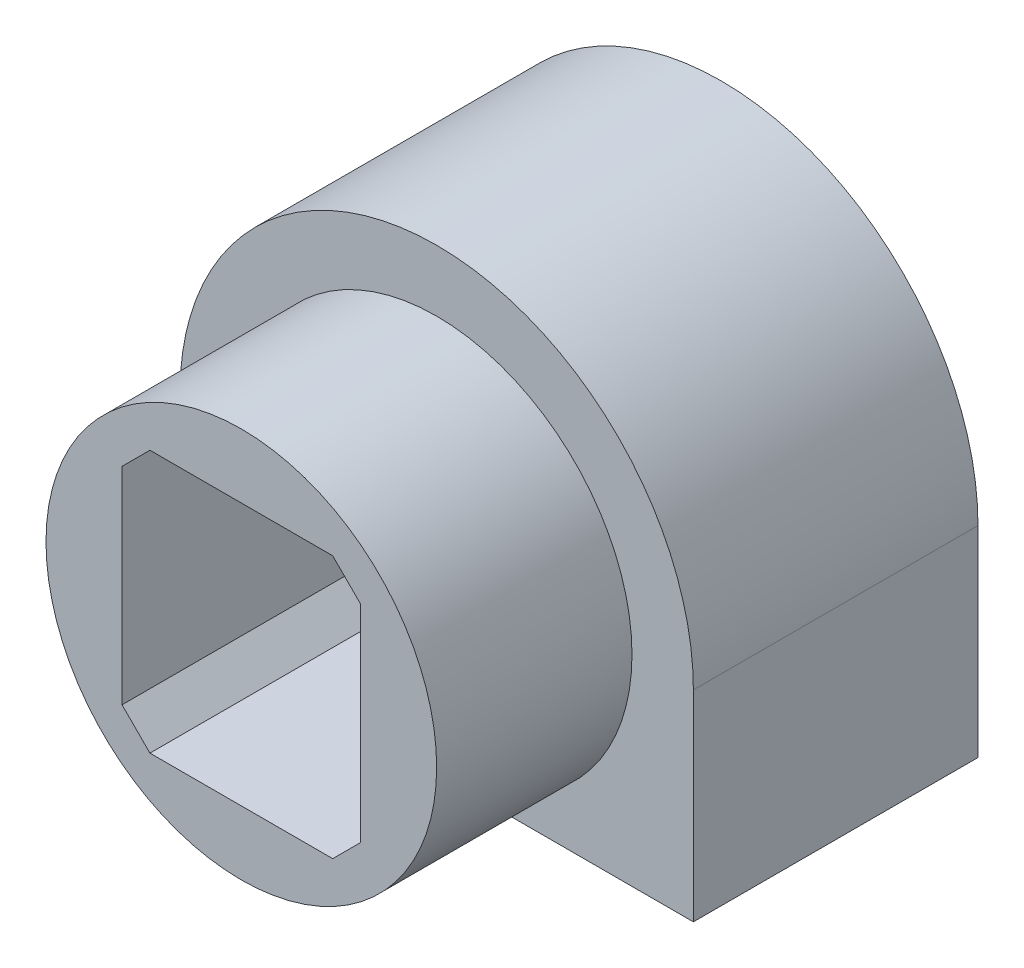
from build123d import *

# Parameters (mm, degrees)
SALIENTE_EXTRUIR1_DEPTH = 51
CROQUIS2_R              = 35
SALIENTE_EXTRUIR3_DEPTH = 35
CORTAR_EXTRUIR1_DEPTH   = 53
CORTAR_EXTRUIR2_DEPTH   = 30
CROQUIS6_R              = 1.5
CORTAR_EXTRUIR3_DEPTH   = 27
CORTAR_EXTRUIR4_DEPTH   = 29
CROQUIS8_R              = 1.5
CORTAR_EXTRUIR5_DEPTH   = 136.782914978
CORTAR_EXTRUIR6_DEPTH   = 4
CROQUIS10_R             = 1.5
CORTAR_EXTRUIR7_DEPTH   = 12.5
CROQUIS11_W             = 24
CROQUIS11_H             = 8
CORTAR_EXTRUIR8_DEPTH   = 18
CROQUIS12_R             = 3.5
CORTAR_EXTRUIR9_DEPTH   = 5
CROQUIS13_R             = 16.5
CORTAR_EXTRUIR10_DEPTH  = 3


with BuildPart() as part:
    # Croquis1 → Saliente-Extruir1 (new body)
    with BuildSketch(Plane.XY):
        with BuildLine():
            Line((0, 0), (92, 0))
            Line((92, 0), (92, 36))
            ThreePointArc((92, 36), (46, 82), (0, 36))
            Line((0, 36), (0, 0))
        make_face()
    extrude(amount=-SALIENTE_EXTRUIR1_DEPTH)

    # Croquis2 → Saliente-Extruir3 (add)
    with BuildSketch(Plane.XY):
        with Locations((46, 36)):
            Circle(CROQUIS2_R)
    extrude(amount=SALIENTE_EXTRUIR3_DEPTH)

    # Croquis4 → Cortar-Extruir1 (cut)
    with BuildSketch(Plane.XY.offset(35)):
        Polygon((24.625, 54.5), (29.625, 59.5), (62.375, 59.5), (67.375, 54.5), (67.375, 17.5), (62.375, 12.5), (29.625, 12.5), (24.625, 17.5), align=None)
    extrude(amount=-CORTAR_EXTRUIR1_DEPTH, mode=Mode.SUBTRACT)

    # Croquis5 → Cortar-Extruir2 (cut)
    with BuildSketch(Plane.XY.offset(-18)):
        with BuildLine():
            ThreePointArc((64.5, 36), (38.24596879, 52.796577032), (34, 21.91987216))
            Line((34, 21.91987216), (58, 21.91987216))
            ThreePointArc((58, 21.91987216), (62.796577032, 28.24596879), (64.5, 36))
        make_face()
        with BuildLine():
            Line((58, 21.91987216), (34, 21.91987216))
            ThreePointArc((34, 21.91987216), (46, 17.5), (58, 21.91987216))
        make_face()
        with BuildLine():
            Line((34, 21.91987216), (34, 12.5))
            Line((34, 12.5), (58, 12.5))
            Line((58, 12.5), (58, 21.91987216))
            ThreePointArc((58, 21.91987216), (46, 17.5), (34, 21.91987216))
        make_face()
    extrude(amount=-CORTAR_EXTRUIR2_DEPTH, mode=Mode.SUBTRACT)

    # Croquis6 → Cortar-Extruir3 (cut)
    with BuildSketch(Plane.XY.offset(-48)):
        with BuildLine():
            ThreePointArc((37.600505063, 26.100505063), (36.711457596, 27.470445574), (35.098189059, 27.216463229))
            ThreePointArc((35.098189059, 27.216463229), (36.100505063, 26.100505063), (37.216463229, 25.098189059))
            ThreePointArc((37.216463229, 25.098189059), (37.501207967, 25.563819517), (37.600505063, 26.100505063))
        make_face()
        with BuildLine():
            ThreePointArc((37.216463229, 25.098189059), (36.100505063, 26.100505063), (35.098189059, 27.216463229))
            ThreePointArc((35.098189059, 27.216463229), (35.039844892, 25.039844892), (37.216463229, 25.098189059))
        make_face()
        with BuildLine():
            ThreePointArc((57.399494937, 26.100505063), (57.269435447, 26.711457596), (56.901810941, 27.216463229))
            ThreePointArc((56.901810941, 27.216463229), (55.899494937, 26.100505063), (54.783536771, 25.098189059))
            ThreePointArc((54.783536771, 25.098189059), (56.436180483, 24.69980216), (57.399494937, 26.100505063))
        make_face()
        with BuildLine():
            ThreePointArc((54.783536771, 25.098189059), (55.899494937, 26.100505063), (56.901810941, 27.216463229))
            ThreePointArc((56.901810941, 27.216463229), (54.838834765, 27.161165235), (54.783536771, 25.098189059))
        make_face()
        with Locations((55.899494937, 45.899494937)):
            Circle(CROQUIS6_R)
        with BuildLine():
            Line((54.131727984, 44.131727984), (46, 36))
            Line((46, 36), (37.868272016, 44.131727984))
            ThreePointArc((37.868272016, 44.131727984), (41.599140528, 25.375385376), (57.5, 36))
            ThreePointArc((57.5, 36), (56.624614624, 40.400859472), (54.131727984, 44.131727984))
        make_face()
        with BuildLine():
            Line((46, 47.5), (46, 36))
            Line((46, 36), (54.131727984, 44.131727984))
            ThreePointArc((54.131727984, 44.131727984), (50.400859472, 46.624614624), (46, 47.5))
        make_face()
        with BuildLine():
            Line((37.868272016, 44.131727984), (46, 36))
            Line((46, 36), (46, 47.5))
            ThreePointArc((46, 47.5), (41.599140528, 46.624614624), (37.868272016, 44.131727984))
        make_face()
        with Locations((36.100505063, 45.899494937)):
            Circle(CROQUIS6_R)
    extrude(amount=-CORTAR_EXTRUIR3_DEPTH, mode=Mode.SUBTRACT)

    # Croquis7 → Cortar-Extruir4 (cut)
    with BuildSketch(Plane(origin=(0, 0, -51), x_dir=(-1, 0, 0), z_dir=(0, 0, -1))):
        with BuildLine():
            ThreePointArc((-58.5, 51.5), (-63.621320344, 53.621320344), (-61.5, 48.5))
            Line((-61.5, 48.5), (-61.5, 51.5))
            Line((-61.5, 51.5), (-58.5, 51.5))
        make_face()
        with BuildLine():
            Line((-61.5, 51.5), (-61.5, 48.5))
            ThreePointArc((-61.5, 48.5), (-59.378679656, 49.378679656), (-58.5, 51.5))
            Line((-58.5, 51.5), (-61.5, 51.5))
        make_face()
        with BuildLine():
            Line((-61.5, 23.5), (-61.5, 20.5))
            Line((-61.5, 20.5), (-58.5, 20.5))
            ThreePointArc((-58.5, 20.5), (-59.378679656, 22.621320344), (-61.5, 23.5))
        make_face()
        with BuildLine():
            Line((-58.5, 20.5), (-61.5, 20.5))
            Line((-61.5, 20.5), (-61.5, 23.5))
            ThreePointArc((-61.5, 23.5), (-63.621320344, 18.378679656), (-58.5, 20.5))
        make_face()
        with BuildLine():
            ThreePointArc((-30.5, 23.5), (-32.621320344, 22.621320344), (-33.5, 20.5))
            Line((-33.5, 20.5), (-30.5, 20.5))
            Line((-30.5, 20.5), (-30.5, 23.5))
        make_face()
        with BuildLine():
            Line((-30.5, 20.5), (-33.5, 20.5))
            ThreePointArc((-33.5, 20.5), (-30.5, 17.5), (-27.5, 20.5))
            ThreePointArc((-27.5, 20.5), (-28.378679656, 22.621320344), (-30.5, 23.5))
            Line((-30.5, 23.5), (-30.5, 20.5))
        make_face()
        with BuildLine():
            ThreePointArc((-33.5, 51.5), (-32.621320344, 49.378679656), (-30.5, 48.5))
            Line((-30.5, 48.5), (-30.5, 51.5))
            Line((-30.5, 51.5), (-33.5, 51.5))
        make_face()
        with BuildLine():
            Line((-30.5, 51.5), (-30.5, 48.5))
            ThreePointArc((-30.5, 48.5), (-28.378679656, 49.378679656), (-27.5, 51.5))
            ThreePointArc((-27.5, 51.5), (-30.5, 54.5), (-33.5, 51.5))
            Line((-33.5, 51.5), (-30.5, 51.5))
        make_face()
    extrude(amount=-CORTAR_EXTRUIR4_DEPTH, mode=Mode.SUBTRACT)

    # Croquis8 → Cortar-Extruir5 (cut, through all)
    with BuildSketch(Plane(origin=(0, 0, -22), x_dir=(-1, 0, 0), z_dir=(0, 0, -1))):
        with Locations((-61.5, 51.5)):
            Circle(CROQUIS8_R)
        with Locations((-30.5, 51.5)):
            Circle(CROQUIS8_R)
        with Locations((-30.5, 20.5)):
            Circle(CROQUIS8_R)
        with Locations((-61.5, 20.5)):
            Circle(CROQUIS8_R)
    extrude(amount=-CORTAR_EXTRUIR5_DEPTH, mode=Mode.SUBTRACT)

    # Croquis9 → Cortar-Extruir6 (cut)
    with BuildSketch(Plane(origin=(0, 0, -51), x_dir=(-1, 0, 0), z_dir=(0, 0, -1))):
        with BuildLine():
            ThreePointArc((-45, 59), (-45.292893219, 59.707106781), (-46, 60))
            Line((-46, 60), (-46, 58))
            ThreePointArc((-46, 58), (-45.292893219, 58.292893219), (-45, 59))
        make_face()
        with BuildLine():
            Line((-46, 58), (-46, 60))
            ThreePointArc((-46, 60), (-47, 59), (-46, 58))
        make_face()
        with BuildLine():
            ThreePointArc((-45, 52.25), (-45.292893219, 52.957106781), (-46, 53.25))
            Line((-46, 53.25), (-46, 51.25))
            ThreePointArc((-46, 51.25), (-45.292893219, 51.542893219), (-45, 52.25))
        make_face()
        with BuildLine():
            Line((-46, 51.25), (-46, 53.25))
            ThreePointArc((-46, 53.25), (-47, 52.25), (-46, 51.25))
        make_face()
        with BuildLine():
            ThreePointArc((-45, 19.75), (-45.292893219, 20.457106781), (-46, 20.75))
            Line((-46, 20.75), (-46, 18.75))
            ThreePointArc((-46, 18.75), (-45.292893219, 19.042893219), (-45, 19.75))
        make_face()
        with BuildLine():
            Line((-46, 18.75), (-46, 20.75))
            ThreePointArc((-46, 20.75), (-47, 19.75), (-46, 18.75))
        make_face()
        with BuildLine():
            ThreePointArc((-45, 13), (-45.292893219, 13.707106781), (-46, 14))
            Line((-46, 14), (-46, 12))
            ThreePointArc((-46, 12), (-45.292893219, 12.292893219), (-45, 13))
        make_face()
        with BuildLine():
            Line((-46, 12), (-46, 14))
            ThreePointArc((-46, 14), (-47, 13), (-46, 12))
        make_face()
    extrude(amount=-CORTAR_EXTRUIR6_DEPTH, mode=Mode.SUBTRACT)

    # Croquis10 → Cortar-Extruir7 (cut)
    with BuildSketch(Plane.XZ):
        with Locations(Location((46, -5, 0), (0, 0, 270))):
            Circle(CROQUIS10_R)
        with Locations(Location((58, -17, 0), (0, 0, 270))):
            Circle(CROQUIS10_R)
        with Locations(Location((46, -29, 0), (0, 0, 270))):
            Circle(CROQUIS10_R)
        with Locations(Location((34, -17, 0), (0, 0, 270))):
            Circle(CROQUIS10_R)
    extrude(amount=-CORTAR_EXTRUIR7_DEPTH, mode=Mode.SUBTRACT)

    # Croquis11 → Cortar-Extruir8 (cut)
    with BuildSketch(Plane.XZ):
        with Locations((46, -41)):
            Rectangle(CROQUIS11_W, CROQUIS11_H)
    extrude(amount=-CORTAR_EXTRUIR8_DEPTH, mode=Mode.SUBTRACT)

    # Croquis12 → Cortar-Extruir9 (cut)
    with BuildSketch(Plane(origin=(0, 12.5, 0), x_dir=(1, 0, 0), z_dir=(0, 1, 0))):
        with Locations((34, 17)):
            Circle(CROQUIS12_R)
        with Locations((58, 17)):
            Circle(CROQUIS12_R)
    extrude(amount=CORTAR_EXTRUIR9_DEPTH, mode=Mode.SUBTRACT)

    # Croquis13 → Cortar-Extruir10 (cut)
    with BuildSketch(Plane.XZ):
        with Locations(Location((46, -17.000083543, 0), (0, 0, 270))):
            Circle(CROQUIS13_R)
    extrude(amount=-CORTAR_EXTRUIR10_DEPTH, mode=Mode.SUBTRACT)


solid = part.part
